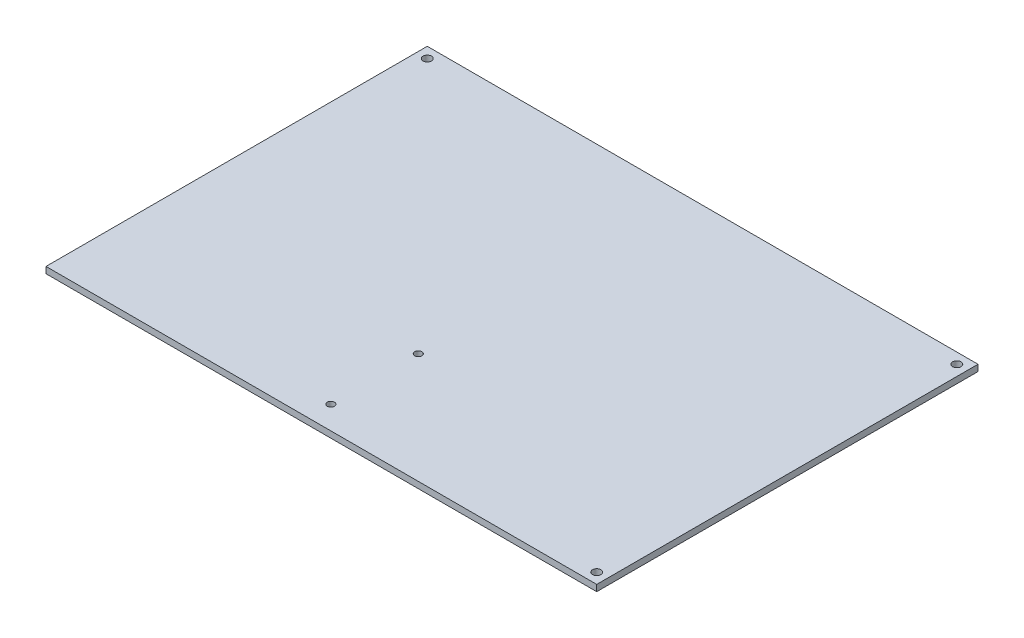
from build123d import *

# Parameters (mm, degrees)
SKETCH1_W           = 260
SKETCH1_H           = 180
BOSS_EXTRUDE1_DEPTH = 3
SKETCH2_R           = 2
CUT_EXTRUDE1_DEPTH  = 159.142340946
SKETCH3_R           = 1.7
CUT_EXTRUDE2_DEPTH  = 10


with BuildPart() as part:
    # Sketch1 → Boss-Extrude1 (new body)
    with BuildSketch(Plane(origin=(0, 0, 0), x_dir=(1, 0, 0), z_dir=(0, 1, 0))):
        Rectangle(SKETCH1_W, SKETCH1_H)
    extrude(amount=BOSS_EXTRUDE1_DEPTH)

    # Sketch2 → Cut-Extrude1 (cut, through all)
    with BuildSketch(Plane(origin=(0, 3, 0), x_dir=(1, 0, 0), z_dir=(0, 1, 0))):
        with Locations(Location((125, -85, 0), (0, 0, 270))):
            Circle(SKETCH2_R)
        with Locations(Location((125, 85, 0), (0, 0, 90))):
            Circle(SKETCH2_R)
        with Locations(Location((-125, 85, 0), (0, 0, 270))):
            Circle(SKETCH2_R)
    extrude(amount=-CUT_EXTRUDE1_DEPTH, mode=Mode.SUBTRACT)

    # Sketch3 → Cut-Extrude2 (cut)
    with BuildSketch(Plane(origin=(0, 3, 0), x_dir=(1, 0, 0), z_dir=(0, 1, 0))):
        with Locations(Location((-6.425, -79.100611393, 0), (0, 0, 270))):
            Circle(SKETCH3_R)
        with Locations(Location((-6.425, -37.825611393, 0), (0, 0, 270))):
            Circle(SKETCH3_R)
    extrude(amount=-CUT_EXTRUDE2_DEPTH, mode=Mode.SUBTRACT)


solid = part.part
